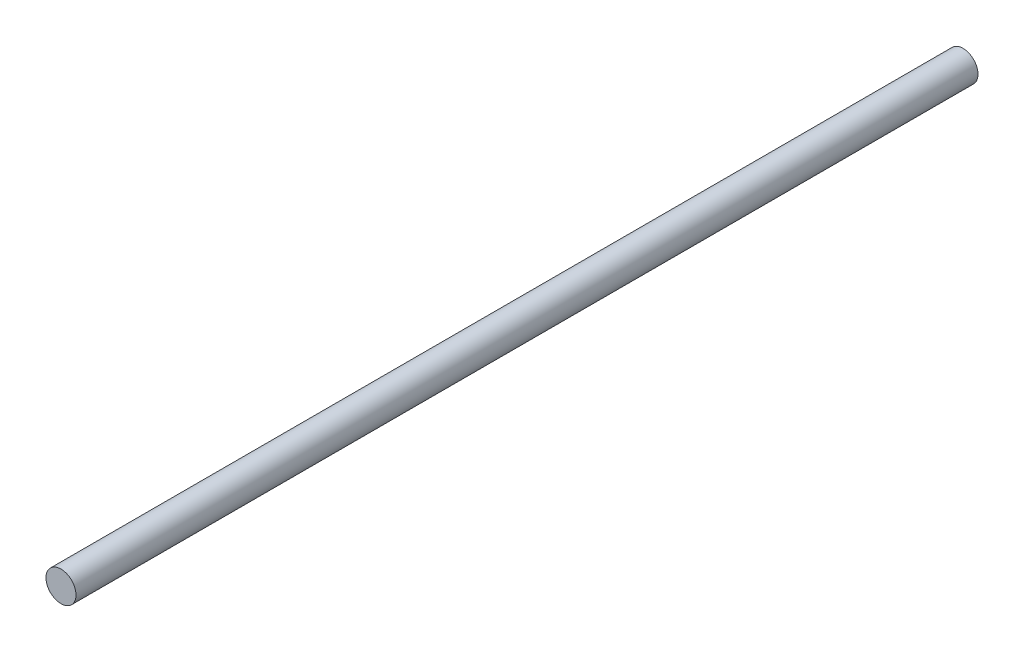
from build123d import *

# Parameters (mm, degrees)
SKETCH1_R           = 5
BOSS_EXTRUDE1_DEPTH = 300.5


with BuildPart() as part:
    # Sketch1 → Boss-Extrude1 (new body)
    with BuildSketch(Plane.XY):
        Circle(SKETCH1_R)
    extrude(amount=-BOSS_EXTRUDE1_DEPTH)


solid = part.part
